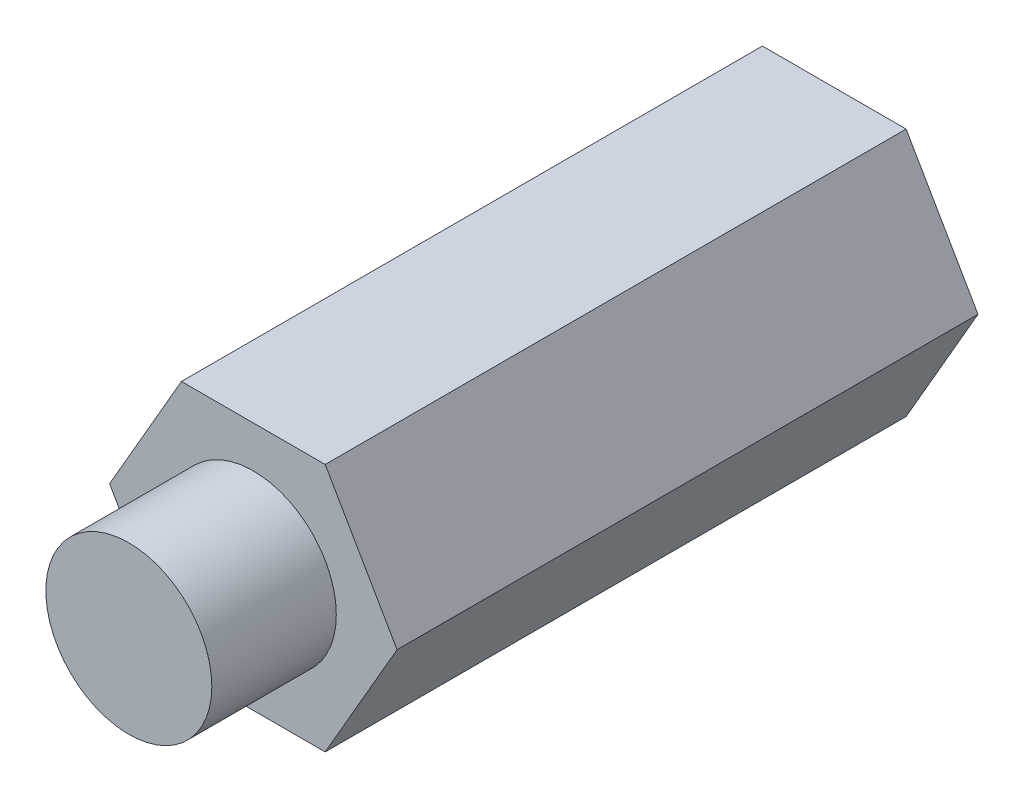
from build123d import *

# Parameters (mm, degrees)
BOSS_EXTRUDE1_DEPTH       = 14
SKETCH2_R                 = 2
BOSS_EXTRUDE2_DEPTH       = 3
F_3_0MM_DOWEL_HOLE1_D     = 3
F_3_0MM_DOWEL_HOLE1_DEPTH = 6
F_3_0MM_DOWEL_HOLE1_TIP   = 0.901290929


with BuildPart() as part:
    # Sketch1 → Boss-Extrude1 (new body)
    with BuildSketch(Plane.XY):
        Polygon((1.732050808, 3), (-1.732050808, 3), (-3.464101615, 0), (-1.732050808, -3), (1.732050808, -3), (3.464101615, 0), align=None)
    extrude(amount=BOSS_EXTRUDE1_DEPTH)

    # Sketch2 → Boss-Extrude2 (add)
    with BuildSketch(Plane.XY.offset(14)):
        Circle(SKETCH2_R)
    extrude(amount=BOSS_EXTRUDE2_DEPTH)

    # Ø3.0mm Dowel Hole1
    with Locations(Plane(origin=(0, 0, 0), x_dir=(-1, 0, 0), z_dir=(0, 0, -1))):
        with Locations((0, 0)):
            Hole(F_3_0MM_DOWEL_HOLE1_D / 2, depth=F_3_0MM_DOWEL_HOLE1_DEPTH)
            with Locations((0, 0, -(F_3_0MM_DOWEL_HOLE1_DEPTH + F_3_0MM_DOWEL_HOLE1_TIP / 2))):  # 118° drill point
                Cone(0, F_3_0MM_DOWEL_HOLE1_D / 2, F_3_0MM_DOWEL_HOLE1_TIP, mode=Mode.SUBTRACT)


solid = part.part
